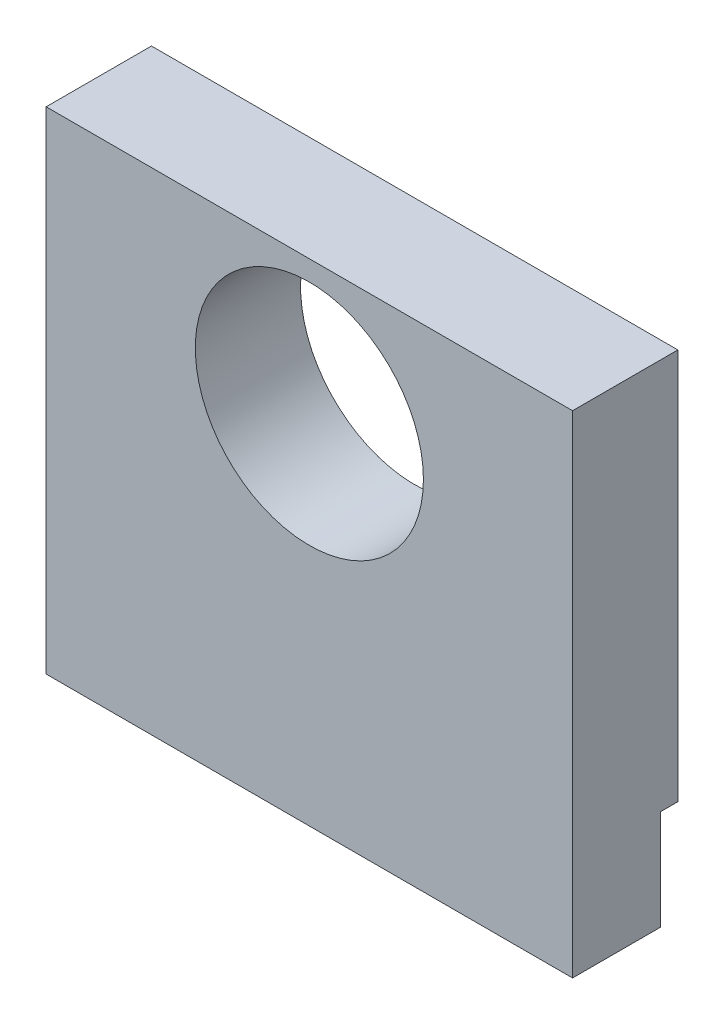
from build123d import *

# Parameters (mm, degrees)
BODY_DEPTH         = 30
SKETCH_4_R         = 6.5
BEARING_HOLE_DEPTH = 6


with BuildPart() as part:
    # Эскиз1 → Body (new body)
    with BuildSketch(Plane.ZY.offset(15)):
        Polygon((137, 2.7), (137, 25), (143, 25), (143, -3), (138, -3), (138, 2.7), align=None)
    extrude(amount=-BODY_DEPTH)

    # Эскиз4 → Bearing_Hole (cut)
    with BuildSketch(Plane.XY.offset(143)):
        with Locations((0, 17.35)):
            Circle(SKETCH_4_R)
    extrude(amount=-BEARING_HOLE_DEPTH, mode=Mode.SUBTRACT)


solid = part.part
